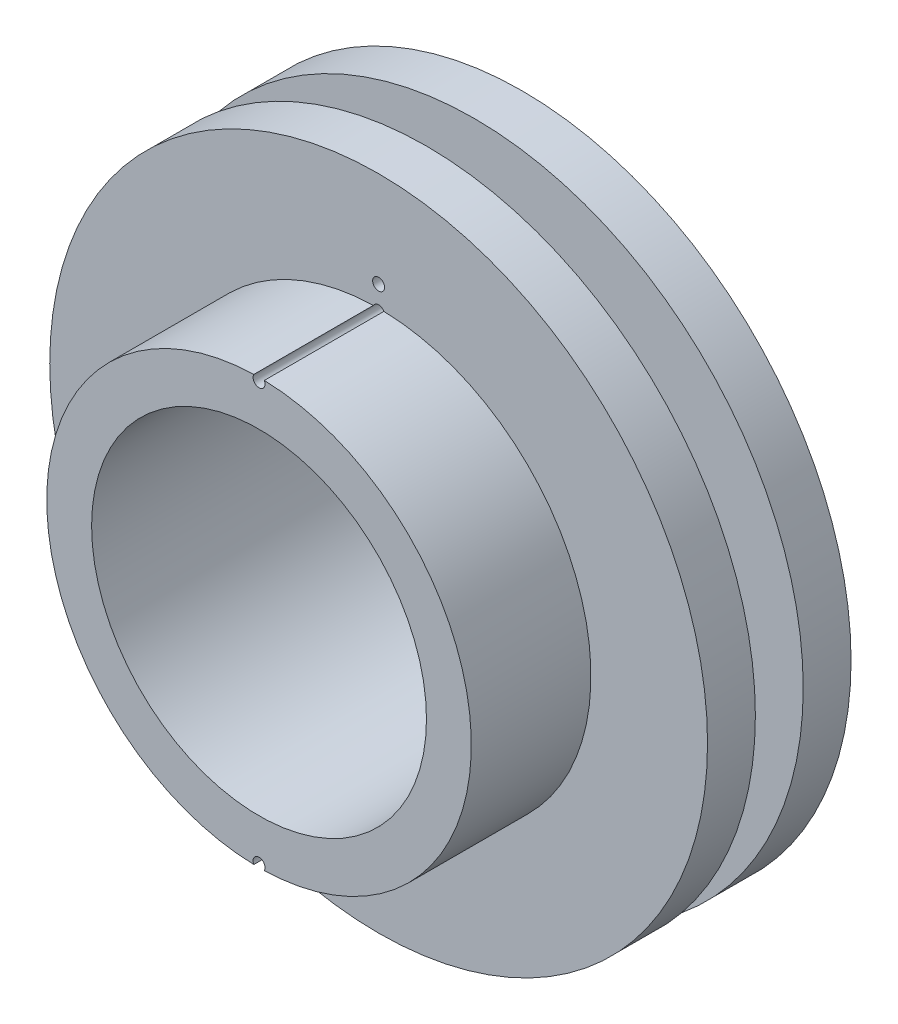
from build123d import *

# Parameters (mm, degrees)
SKETCH1_R           = 13.75
BOSS_EXTRUDE1_DEPTH = 2
SKETCH2_R           = 8.5
BOSS_EXTRUDE2_DEPTH = 6
BOSS_EXTRUDE3_START = 4
SKETCH3_R           = 13.75
BOSS_EXTRUDE3_DEPTH = 2
SKETCH5_R           = 7
CUT_EXTRUDE2_DEPTH  = 21.350061425
BOSS_EXTRUDE4_START = 6
SKETCH6_R           = 8.875
SKETCH6_R_2         = 7
BOSS_EXTRUDE4_DEPTH = 5
CUT_EXTRUDE3_START  = 4
SKETCH9_R           = 0.25
CUT_EXTRUDE3_DEPTH  = 19.341105613


with BuildPart() as part:
    # Sketch1 → Boss-Extrude1 (new body)
    with BuildSketch(Plane.XY):
        Circle(SKETCH1_R)
    extrude(amount=BOSS_EXTRUDE1_DEPTH)

    # Sketch2 → Boss-Extrude2 (add)
    with BuildSketch(Plane.XY):
        Circle(SKETCH2_R)
    extrude(amount=BOSS_EXTRUDE2_DEPTH)

    # Sketch3 → Boss-Extrude3 (add)
    with BuildSketch(Plane.XY.offset(BOSS_EXTRUDE3_START)):
        Circle(SKETCH3_R)
    extrude(amount=BOSS_EXTRUDE3_DEPTH)

    # Sketch5 → Cut-Extrude2 (cut, through all)
    with BuildSketch(Plane.XY):
        Circle(SKETCH5_R)
    extrude(amount=CUT_EXTRUDE2_DEPTH, mode=Mode.SUBTRACT)

    # Sketch6 → Boss-Extrude4 (add)
    with BuildSketch(Plane.XY.offset(BOSS_EXTRUDE4_START)):
        Circle(SKETCH6_R)
        Circle(SKETCH6_R_2, mode=Mode.SUBTRACT)
    extrude(amount=BOSS_EXTRUDE4_DEPTH)

    # Sketch9 → Cut-Extrude3 (cut, through all)
    with BuildSketch(Plane.XY.offset(CUT_EXTRUDE3_START)):
        with Locations((0, 9.75)):
            Circle(SKETCH9_R)
        with Locations((0, -9.75)):
            Circle(SKETCH9_R)
        with Locations(Location((0, 8.75, 0), (0, 0, 150.706355545))):
            Circle(SKETCH9_R)
        with Locations(Location((0, -8.75, 0), (0, 0, 209.293644455))):
            Circle(SKETCH9_R)
    extrude(amount=CUT_EXTRUDE3_DEPTH, mode=Mode.SUBTRACT)


solid = part.part
